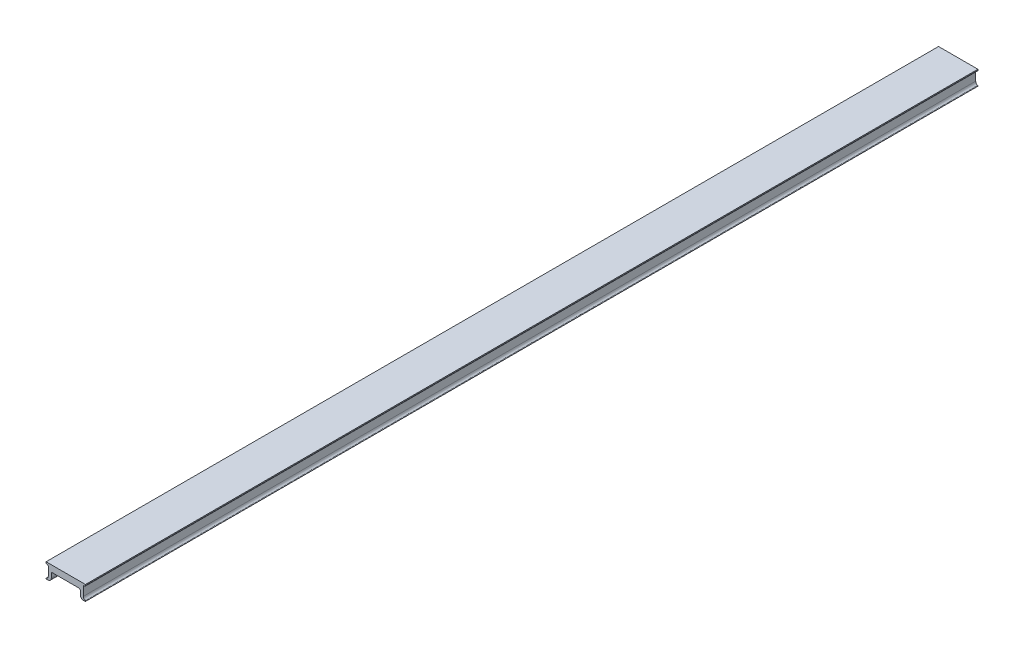
from build123d import *

# Parameters (mm, degrees)
BOSS_EXTRUDE1_DEPTH = 204


with BuildPart() as part:
    # Szkic1 → Boss-Extrude1 (new body)
    with BuildSketch(Plane.XY):
        with BuildLine():
            Line((92.010000436, 51.077414838), (101.009999564, 51.077414838))
            Line((101.009999564, 51.077414838), (101.009999564, 50.859999228))
            ThreePointArc((101.009999564, 50.859999228), (100.95142109, 50.718578281), (100.810000144, 50.659999808))
            Line((100.810000144, 50.659999808), (100.710000374, 50.659999808))
            ThreePointArc((100.710000374, 50.659999808), (100.568578753, 50.601421054), (100.51, 50.459999434))
            Line((100.51, 50.459999434), (100.51, 48.459999434))
            ThreePointArc((100.51, 48.459999434), (100.623168266, 48.085202764), (100.943422808, 47.859999237))
            ThreePointArc((100.943422808, 47.859999237), (101.030642298, 47.766174714), (100.936817775, 47.678955223))
            Line((100.936817775, 47.678955223), (100.57727329, 47.678955223))
            ThreePointArc((100.57727329, 47.678955223), (100.041576562, 47.900848073), (99.819683712, 48.436544801))
            Line((99.819683712, 48.436544801), (99.819683712, 49.359999626))
            ThreePointArc((99.819683712, 49.359999626), (99.743947721, 49.542842483), (99.561104865, 49.618578474))
            Line((99.561104865, 49.618578474), (93.458895135, 49.618578474))
            ThreePointArc((93.458895135, 49.618578474), (93.276052279, 49.542842483), (93.200316288, 49.359999626))
            Line((93.200316288, 49.359999626), (93.200316288, 48.436544801))
            ThreePointArc((93.200316288, 48.436544801), (92.978423438, 47.900848073), (92.44272671, 47.678955223))
            Line((92.44272671, 47.678955223), (92.083182225, 47.678955223))
            ThreePointArc((92.083182225, 47.678955223), (91.989357702, 47.766174714), (92.076577192, 47.859999237))
            ThreePointArc((92.076577192, 47.859999237), (92.396831734, 48.085202764), (92.51, 48.459999434))
            Line((92.51, 48.459999434), (92.51, 50.459999434))
            ThreePointArc((92.51, 50.459999434), (92.451421247, 50.601421054), (92.309999626, 50.659999808))
            Line((92.309999626, 50.659999808), (92.209999856, 50.659999808))
            ThreePointArc((92.209999856, 50.659999808), (92.06857891, 50.718578281), (92.010000436, 50.859999228))
            Line((92.010000436, 50.859999228), (92.010000436, 51.077414838))
        make_face()
    extrude(amount=BOSS_EXTRUDE1_DEPTH)


solid = part.part
